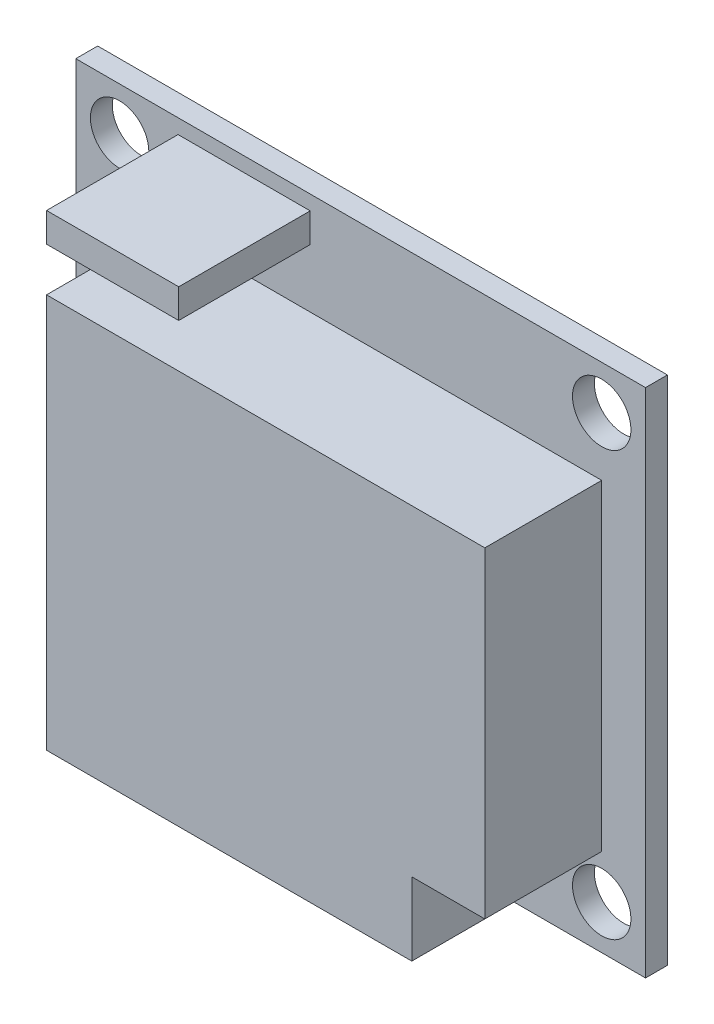
from build123d import *

# Parameters (mm, degrees)
ESQUISSE1_W                     = 39
ESQUISSE1_H                     = 35
BOSS_EXTRU_1_DEPTH              = 1.5
ENL_V_MAT_EXTRU_1_REACH         = 28.244
ESQUISSE2_R                     = 2
R_P_TITION_LIN_AIRE1_COUNT      = 2
R_P_TITION_LIN_AIRE1_PITCH      = 33
R_P_TITION_LIN_AIRE1_COUNT_DIR2 = 2
R_P_TITION_LIN_AIRE1_PITCH_DIR2 = 29
ESQUISSE3_W                     = 9.045882094
ESQUISSE3_H                     = 2
BOSS_EXTRU_2_DEPTH              = 9
BOSS_EXTRU_3_DEPTH              = 8


with BuildPart() as part:
    # Esquisse1 → Boss.-Extru.1 (new body)
    with BuildSketch(Plane.XY):
        Rectangle(ESQUISSE1_W, ESQUISSE1_H)
    extrude(amount=BOSS_EXTRU_1_DEPTH)

    # Esquisse2 → Enlèv. mat.-Extru.1 (cut, up to next)
    with BuildSketch(Plane.XY.offset(1.5), mode=Mode.PRIVATE) as enl_v_mat_extru_1_sk1:
        with Locations((16.5, 14.5)):
            Circle(ESQUISSE2_R)
    enl_v_mat_extru_1_tool1 = extrude(enl_v_mat_extru_1_sk1.sketch, amount=-ENL_V_MAT_EXTRU_1_REACH, mode=Mode.PRIVATE) & part.part
    enl_v_mat_extru_1 = enl_v_mat_extru_1_tool1.solids().sort_by_distance((16.5, 14.5, 1.5))[0]
    add(enl_v_mat_extru_1, mode=Mode.SUBTRACT)

    # Répétition linéaire1: Enl_v. mat.-Extru.1 2 × 2
    with Locations(*[(-i * R_P_TITION_LIN_AIRE1_PITCH, -j * R_P_TITION_LIN_AIRE1_PITCH_DIR2, 0) for i in range(R_P_TITION_LIN_AIRE1_COUNT) for j in range(R_P_TITION_LIN_AIRE1_COUNT_DIR2) if (i, j) != (0, 0)]):
        add(enl_v_mat_extru_1, mode=Mode.SUBTRACT)

    # Esquisse3 → Boss.-Extru.2 (add)
    with BuildSketch(Plane.XY.offset(1.5)):
        with Locations((-7.977058953, 15.5)):
            Rectangle(ESQUISSE3_W, ESQUISSE3_H)
    extrude(amount=BOSS_EXTRU_2_DEPTH)

    # Esquisse4 → Boss.-Extru.3 (add)
    with BuildSketch(Plane.XY.offset(1.5)):
        Polygon((-13.5, 10.5), (16.5, 10.5), (16.5, -11.5), (11.5, -11.5), (11.5, -16.5), (-13.5, -16.5), align=None)
    extrude(amount=BOSS_EXTRU_3_DEPTH)


solid = part.part
